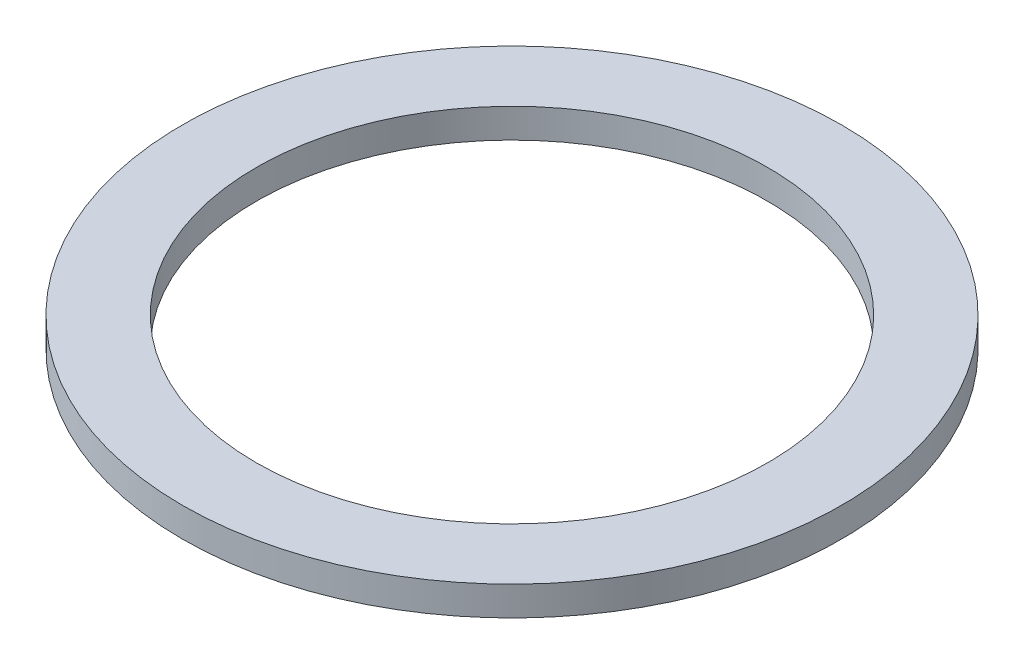
from build123d import *

# Parameters (mm, degrees)
SKETCH1_R           = 9
SKETCH1_R_2         = 6.985
BOSS_EXTRUDE1_DEPTH = 0.8


with BuildPart() as part:
    # Sketch1 → Boss-Extrude1 (new body)
    with BuildSketch(Plane(origin=(0, 0, 0), x_dir=(1, 0, 0), z_dir=(0, 1, 0))):
        with Locations(Location((0, 0, 0), (0, 0, 270))):
            Circle(SKETCH1_R)
        with Locations(Location((0, 0, 0), (0, 0, 270))):
            Circle(SKETCH1_R_2, mode=Mode.SUBTRACT)
    extrude(amount=BOSS_EXTRUDE1_DEPTH)


solid = part.part
